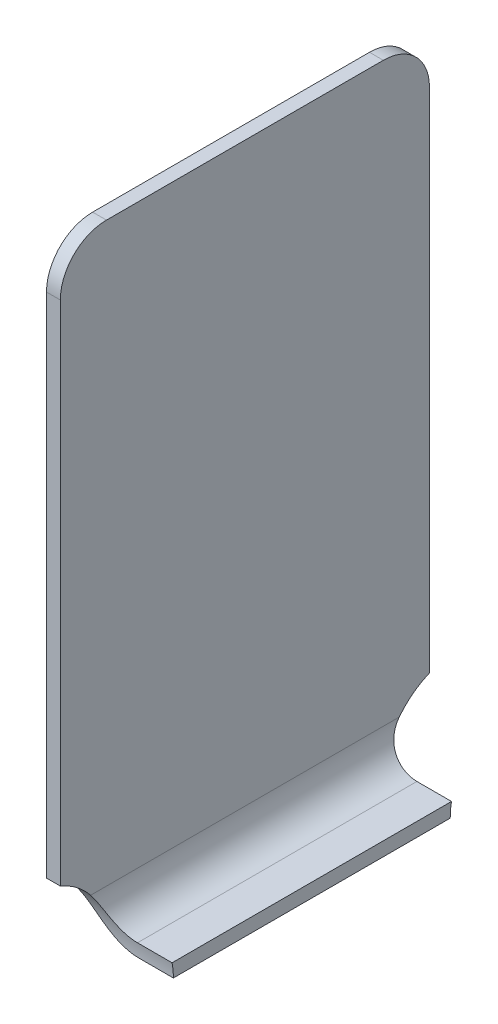
from build123d import *

# Parameters (mm, degrees)
EXTRUDE_THIN1_DEPTH     = 101.6
FILLET1_R               = 25.4
FILLET2_R               = 25.4
CUT_EXTRUDE1_DEPTH      = 15.494
CUT_EXTRUDE1_DEPTH_BACK = 67.818


with BuildPart() as part:
    # Sketch1 → Extrude-Thin1 (new, symmetric)
    with BuildSketch(Plane.XY):
        with BuildLine():
            Line((0, 0), (-19.05, 0))
            ThreePointArc((-19.05, 0), (-37.010512242, 7.439487758), (-44.45, 25.4))
            Line((-44.45, 25.4), (-44.45, 342.9))
            Line((-44.45, 342.9), (-36.83, 342.9))
            Line((-36.83, 342.9), (-36.83, 25.4))
            ThreePointArc((-36.83, 25.4), (-31.622358569, 12.827641431), (-19.05, 7.62))
            Line((-19.05, 7.62), (0, 7.62))
            Line((0, 7.62), (0, 0))
        make_face()
    extrude(amount=EXTRUDE_THIN1_DEPTH, both=True)

    # Fillet1
    fillet1_edges = [part.edges().sort_by_distance(p)[0] for p in [
        (-40.64, 342.9, 101.6),
    ]]
    fillet(fillet1_edges, radius=FILLET1_R)

    # Fillet2
    fillet2_edges = [part.edges().sort_by_distance(p)[0] for p in [
        (-40.64, 342.9, -101.6),
    ]]
    fillet(fillet2_edges, radius=FILLET2_R)

    # Sketch2 → Cut-Extrude1 (cut, two sides: drawn at the far end of the back side and taken through both)
    with BuildSketch(Plane(origin=(0, 0, 0), x_dir=(0, 0, -1), z_dir=(1, 0, 0)).offset(-CUT_EXTRUDE1_DEPTH_BACK)):
        with BuildLine():
            Line((-101.6, 0), (-76.2, 0))
            ThreePointArc((-76.2, 0), (-83.132124101, 22.895250599), (-101.6, 38.1))
            Line((-101.6, 38.1), (-101.6, 0))
        make_face()
        with BuildLine():
            Line((101.6, 0), (101.6, 38.1))
            ThreePointArc((101.6, 38.1), (83.132124101, 22.895250599), (76.2, 0))
            Line((76.2, 0), (101.6, 0))
        make_face()
    extrude(amount=CUT_EXTRUDE1_DEPTH + CUT_EXTRUDE1_DEPTH_BACK, mode=Mode.SUBTRACT)


solid = part.part
